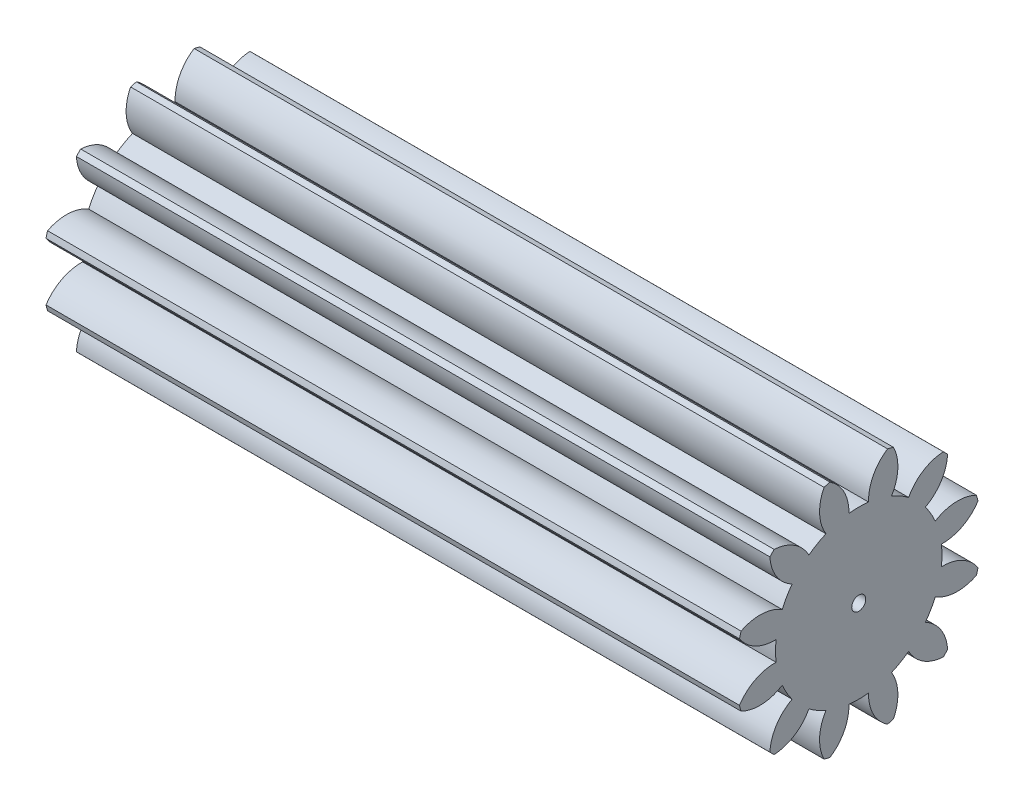
from build123d import *

# Parameters (mm, degrees)
BASPROSKE_W        = 39.565
BASPROSKE_H        = 7
TOOTHCUT_DEPTH     = 41.784668995
TEETHCUTS_COUNT    = 12
TEETHCUTS_ANGLE    = 330
BORSKE_R           = 0.4
BORE_DEPTH         = 50.0000508
SCALE1_SCALE       = 2
SKETCH5_R          = 4
CUT_EXTRUDE2_DEPTH = 5
CUT_EXTRUDE4_DEPTH = 15


with BuildPart() as part:
    # BasProSke → Base-Revolve (revolve)
    with BuildSketch(Plane(origin=(0, 0, 0), x_dir=(1, 0, 0), z_dir=(0, 1, 0)), mode=Mode.PRIVATE) as base_revolve_sk:
        with Locations((19.7825, 3.5)):
            Rectangle(BASPROSKE_W, BASPROSKE_H)
    revolve(base_revolve_sk.sketch.rotate(Axis((-10, 0, 0), (1, 0, 0)), 180), axis=Axis((-10, 0, 0), (1, 0, 0)))

    # TooCutSke → ToothCut (cut, through all)
    with BuildSketch(Plane(origin=(0, 0, 0), x_dir=(0, 0, -1), z_dir=(1, 0, 0))):
        with BuildLine():
            ThreePointArc((0.562207301, 4.715604304), (0, 4.749), (-0.562207301, 4.715604304))
            ThreePointArc((-0.562207301, 4.715604304), (-0.837528627, 5.917009812), (-1.672850686, 6.823328788))
            ThreePointArc((-1.672850686, 6.823328788), (0, 7.0254), (1.672850686, 6.823328788))
            ThreePointArc((1.672850686, 6.823328788), (0.837528627, 5.917009812), (0.562207301, 4.715604304))
        make_face()
    toothcut = extrude(amount=TOOTHCUT_DEPTH, mode=Mode.SUBTRACT)

    # TeethCuts: ToothCut ×12 about axis
    teethcuts_axis = Axis((-10, 0, 0), (1, 0, 0))
    for i in range(1, TEETHCUTS_COUNT):
        add(toothcut.rotate(teethcuts_axis, i * TEETHCUTS_ANGLE / (TEETHCUTS_COUNT - 1)), mode=Mode.SUBTRACT)

    # BorSke → Bore (cut, symmetric)
    with BuildSketch(Plane(origin=(0, 0, 0), x_dir=(0, 0, -1), z_dir=(1, 0, 0))):
        with Locations(Location((0, 0, 0), (0, 0, 180))):
            Circle(BORSKE_R)
    extrude(amount=BORE_DEPTH, both=True, mode=Mode.SUBTRACT)


with BuildPart() as part_1:
    # Scale1: scaled about (19.7825, 0, 0)
    add(part.part.scale(SCALE1_SCALE).moved(Location((-19.7825, 0, 0))))

    # Sketch5 → Cut-Extrude2 (cut)
    with BuildSketch(Plane.ZY.offset(19.7825)):
        Circle(SKETCH5_R)
    extrude(amount=-CUT_EXTRUDE2_DEPTH, mode=Mode.SUBTRACT)

    # Sketch8 → Cut-Extrude4 (cut)
    with BuildSketch(Plane.ZY.offset(14.7825)):
        with BuildLine():
            Line((-1.85, 0), (-1.85, 3.546477125))
            ThreePointArc((-1.85, 3.546477125), (4, 0), (-1.85, -3.546477125))
            Line((-1.85, -3.546477125), (-1.85, 0))
        make_face()
    extrude(amount=-CUT_EXTRUDE4_DEPTH, mode=Mode.SUBTRACT)


solid = part_1.part
